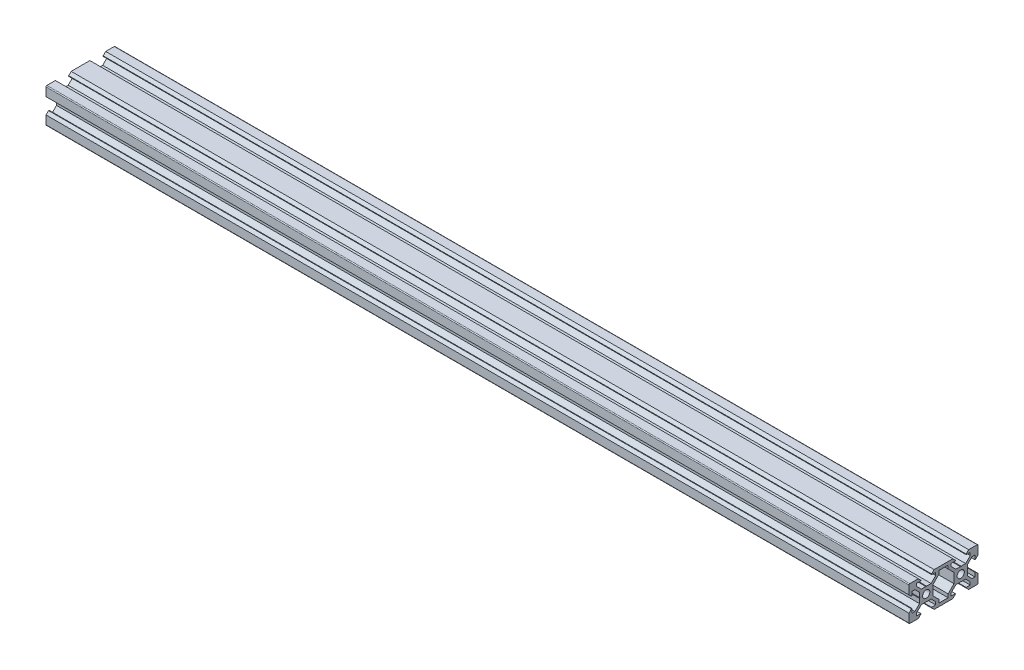
from build123d import *

# Parameters (mm, degrees)
PROFILE_SKETCH_R      = 2.1
PROFILE_EXTRUDE_DEPTH = 500


with BuildPart() as part:
    # Profile Sketch → Profile Extrude (new body)
    with BuildSketch(Plane(origin=(0, 0, 0), x_dir=(0, 0, -1), z_dir=(1, 0, 0))):
        with BuildLine():
            Line((5.42, 10), (-5.42, 10))
            Line((-5.42, 10), (-6.875, 8.545))
            Line((-6.875, 8.545), (-6.875, 8.2))
            Line((-6.875, 8.2), (-4.5, 8.2))
            Line((-4.5, 8.2), (-4.5, 6.56))
            Line((-4.5, 6.56), (-7.16, 3.9))
            Line((-7.16, 3.9), (-9.79, 3.9))
            Line((-9.79, 3.9), (-10, 3.69))
            Line((-10, 3.69), (-10.21, 3.9))
            Line((-10.21, 3.9), (-12.84, 3.9))
            Line((-12.84, 3.9), (-15.5, 6.56))
            Line((-15.5, 6.56), (-15.5, 8.2))
            Line((-15.5, 8.2), (-13.125, 8.2))
            Line((-13.125, 8.2), (-13.125, 8.545))
            Line((-13.125, 8.545), (-14.58, 10))
            Line((-14.58, 10), (-19.5, 10))
            ThreePointArc((-19.5, 10), (-19.853553391, 9.853553391), (-20, 9.5))
            Line((-20, 9.5), (-20, 4.58))
            Line((-20, 4.58), (-18.545, 3.125))
            Line((-18.545, 3.125), (-18.2, 3.125))
            Line((-18.2, 3.125), (-18.2, 5.5))
            Line((-18.2, 5.5), (-16.56, 5.5))
            Line((-16.56, 5.5), (-13.9, 2.838679656))
            Line((-13.9, 2.838679656), (-13.9, 0.21))
            Line((-13.9, 0.21), (-13.69, 0))
            Line((-13.69, 0), (-13.9, -0.21))
            Line((-13.9, -0.21), (-13.9, -2.838679656))
            Line((-13.9, -2.838679656), (-16.56, -5.5))
            Line((-16.56, -5.5), (-18.2, -5.5))
            Line((-18.2, -5.5), (-18.2, -3.125))
            Line((-18.2, -3.125), (-18.545, -3.125))
            Line((-18.545, -3.125), (-20, -4.58))
            Line((-20, -4.58), (-20, -9.5))
            ThreePointArc((-20, -9.5), (-19.853553391, -9.853553391), (-19.5, -10))
            Line((-19.5, -10), (-14.58, -10))
            Line((-14.58, -10), (-13.125, -8.545))
            Line((-13.125, -8.545), (-13.125, -8.2))
            Line((-13.125, -8.2), (-15.5, -8.2))
            Line((-15.5, -8.2), (-15.5, -6.56))
            Line((-15.5, -6.56), (-12.84, -3.9))
            Line((-12.84, -3.9), (-10.21, -3.9))
            Line((-10.21, -3.9), (-10, -3.69))
            Line((-10, -3.69), (-9.79, -3.9))
            Line((-9.79, -3.9), (-7.16, -3.9))
            Line((-7.16, -3.9), (-4.5, -6.56))
            Line((-4.5, -6.56), (-4.5, -8.2))
            Line((-4.5, -8.2), (-6.875, -8.2))
            Line((-6.875, -8.2), (-6.875, -8.545))
            Line((-6.875, -8.545), (-5.42, -10))
            Line((-5.42, -10), (5.42, -10))
            Line((5.42, -10), (6.875, -8.545))
            Line((6.875, -8.545), (6.875, -8.2))
            Line((6.875, -8.2), (4.5, -8.2))
            Line((4.5, -8.2), (4.5, -6.56))
            Line((4.5, -6.56), (7.16, -3.9))
            Line((7.16, -3.9), (9.79, -3.9))
            Line((9.79, -3.9), (10, -3.69))
            Line((10, -3.69), (10.21, -3.9))
            Line((10.21, -3.9), (12.84, -3.9))
            Line((12.84, -3.9), (15.5, -6.56))
            Line((15.5, -6.56), (15.5, -8.2))
            Line((15.5, -8.2), (13.125, -8.2))
            Line((13.125, -8.2), (13.125, -8.545))
            Line((13.125, -8.545), (14.58, -10))
            Line((14.58, -10), (19.5, -10))
            ThreePointArc((19.5, -10), (19.853553391, -9.853553391), (20, -9.5))
            Line((20, -9.5), (20, -4.58))
            Line((20, -4.58), (18.545, -3.125))
            Line((18.545, -3.125), (18.2, -3.125))
            Line((18.2, -3.125), (18.2, -5.5))
            Line((18.2, -5.5), (16.56, -5.5))
            Line((16.56, -5.5), (13.9, -2.838679656))
            Line((13.9, -2.838679656), (13.9, -0.21))
            Line((13.9, -0.21), (13.69, 0))
            Line((13.69, 0), (13.9, 0.21))
            Line((13.9, 0.21), (13.9, 2.838679656))
            Line((13.9, 2.838679656), (16.56, 5.5))
            Line((16.56, 5.5), (18.2, 5.5))
            Line((18.2, 5.5), (18.2, 3.125))
            Line((18.2, 3.125), (18.545, 3.125))
            Line((18.545, 3.125), (20, 4.58))
            Line((20, 4.58), (20, 9.5))
            ThreePointArc((20, 9.5), (19.853553391, 9.853553391), (19.5, 10))
            Line((19.5, 10), (14.58, 10))
            Line((14.58, 10), (13.125, 8.545))
            Line((13.125, 8.545), (13.125, 8.2))
            Line((13.125, 8.2), (15.5, 8.2))
            Line((15.5, 8.2), (15.5, 6.56))
            Line((15.5, 6.56), (12.84, 3.9))
            Line((12.84, 3.9), (10.21, 3.9))
            Line((10.21, 3.9), (10, 3.69))
            Line((10, 3.69), (9.79, 3.9))
            Line((9.79, 3.9), (7.16, 3.9))
            Line((7.16, 3.9), (4.5, 6.56))
            Line((4.5, 6.56), (4.5, 8.2))
            Line((4.5, 8.2), (6.875, 8.2))
            Line((6.875, 8.2), (6.875, 8.545))
            Line((6.875, 8.545), (5.42, 10))
        make_face()
        with Locations((-10, 0)):
            Circle(PROFILE_SKETCH_R, mode=Mode.SUBTRACT)
        with Locations((10, 0)):
            Circle(PROFILE_SKETCH_R, mode=Mode.SUBTRACT)
        Polygon((2.7, 8.2), (-2.7, 8.2), (-2.7, 6.238679656), (-6.1, 2.838679656), (-6.1, -0.21), (-6.1, -2.838679656), (-2.7, -6.238679656), (-2.7, -8.2), (2.7, -8.2), (2.7, -6.238679656), (6.1, -2.838679656), (6.1, -0.21), (6.1, 2.838679656), (2.7, 6.238679656), align=None, mode=Mode.SUBTRACT)
    extrude(amount=PROFILE_EXTRUDE_DEPTH)


solid = part.part
